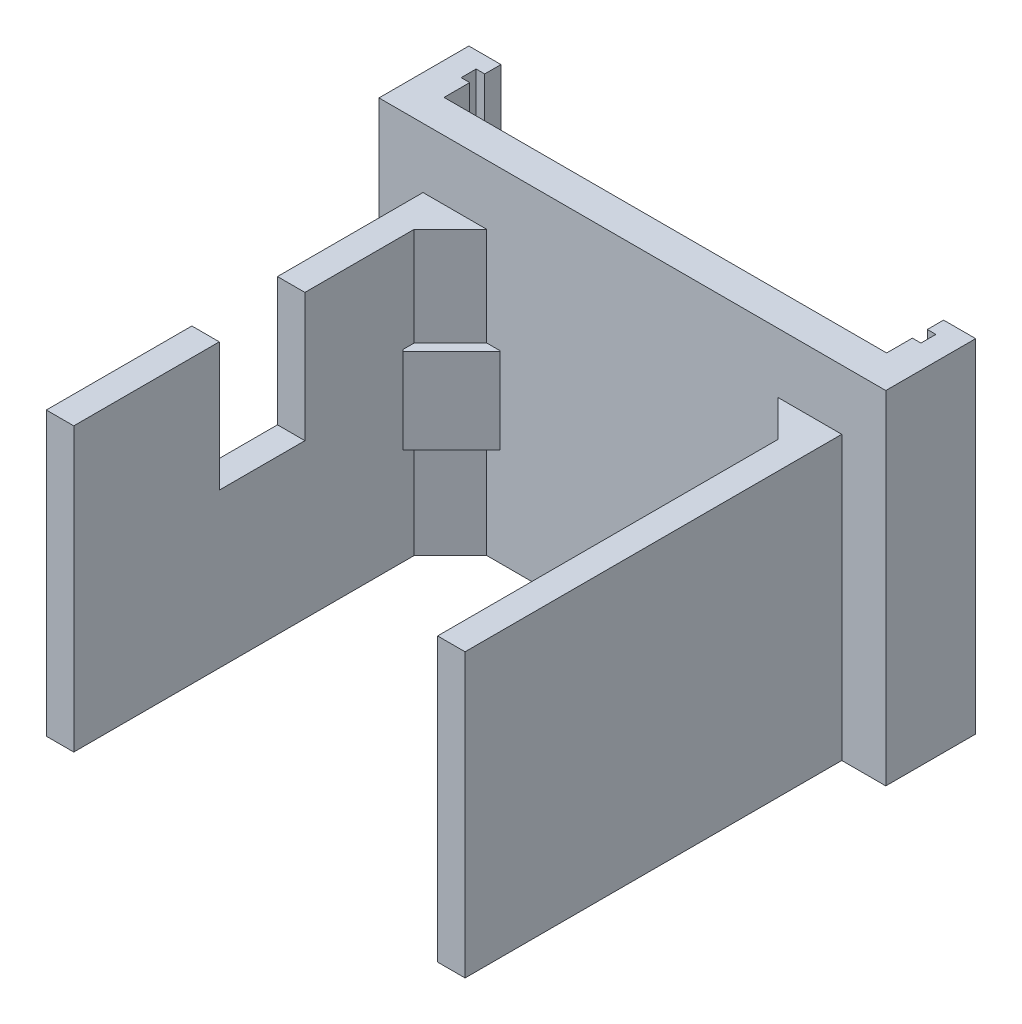
from build123d import *

# Parameters (mm, degrees)
SKETCH1_W             = 3.207256709
SKETCH1_H             = 44
BOSS_EXTRUDE2_DEPTH   = 33
BOSS_EXTRUDE2_2_DEPTH = 33
BOSS_EXTRUDE3_DEPTH   = 40
CHAMFER4_SIZE         = 4.23
SKETCH2_W             = 8
SKETCH2_H             = 10
BOSS_EXTRUDE4_DEPTH   = 1.2
SKETCH3_W             = 10
SKETCH3_H             = 10
BOSS_EXTRUDE5_DEPTH   = 1.2
SKETCH4_W             = 3.207256709
SKETCH4_H             = 10
CUT_EXTRUDE1_DEPTH    = 15


with BuildPart() as part:
    # Sketch1 → Boss-Extrude2 (new body)
    with BuildSketch(Plane(origin=(0, 0, 0), x_dir=(1, 0, 0), z_dir=(0, 1, 0))):
        with Locations((-22.853628355, 0)):
            Rectangle(SKETCH1_W, SKETCH1_H)
    extrude(amount=BOSS_EXTRUDE2_DEPTH)



with BuildPart() as body_2:
    # Sketch1 → Boss-Extrude2 2 (new body)
    with BuildSketch(Plane(origin=(0, 0, 0), x_dir=(1, 0, 0), z_dir=(0, 1, 0))):
        with Locations((22.853628355, 0)):
            Rectangle(SKETCH1_W, SKETCH1_H)
    extrude(amount=BOSS_EXTRUDE2_2_DEPTH)


with BuildPart() as part_1:
    add(part.part)

    add(body_2.part)  # Boss-Extrude3 merges body 2
    # Sketch1<6> → Boss-Extrude3 (add)
    with BuildSketch(Plane(origin=(0, 0, 0), x_dir=(1, 0, 0), z_dir=(0, 1, 0))):
        Polygon((-25.85, 28.85), (-26.85, 28.85), (-26.85, 30.6), (-25.85, 30.6), (-25.85, 32.5), (-29.6, 32.5), (-29.6, 22), (-24.457256709, 22), (-21.25, 22), (21.25, 22), (23.75, 22), (24.457256709, 22), (29.6, 22), (29.6, 32.5), (25.85, 32.5), (25.85, 30.6), (26.85, 30.6), (26.85, 28.85), (25.85, 28.85), (25.85, 25.85), (-25.85, 25.85), align=None)
    extrude(amount=BOSS_EXTRUDE3_DEPTH)

    # Chamfer4
    chamfer4_edges = [part_1.edges().sort_by_distance(p)[0] for p in [
        (21.25, 16.5, -22),
        (-21.25, 16.5, -22),
    ]]
    chamfer(chamfer4_edges, length=CHAMFER4_SIZE)

    # Sketch2 → Boss-Extrude4 (add)
    with BuildSketch(Plane(origin=(-19.51, 0, -19.51), x_dir=(0.7071067811865509, 0, -0.7071067811865442), z_dir=(0.7071067811865442, 0, 0.7071067811865509))):
        with Locations((0.603606398, 16.5)):
            Rectangle(SKETCH2_W, SKETCH2_H)
    extrude(amount=BOSS_EXTRUDE4_DEPTH)

    # Sketch3 → Boss-Extrude5 (add)
    with BuildSketch(Plane(origin=(19.51, 0, -19.51), x_dir=(0.7071067811865442, 0, 0.7071067811865509), z_dir=(-0.7071067811865509, 0, 0.7071067811865442))):
        with Locations((-0.530330086, 16.5)):
            Rectangle(SKETCH3_W, SKETCH3_H)
    extrude(amount=BOSS_EXTRUDE5_DEPTH)

    # Sketch4 → Cut-Extrude1 (cut)
    with BuildSketch(Plane(origin=(0, 33, 0), x_dir=(1, 0, 0), z_dir=(0, 1, 0))):
        with Locations((-22.853628355, 0)):
            Rectangle(SKETCH4_W, SKETCH4_H)
    extrude(amount=-CUT_EXTRUDE1_DEPTH, mode=Mode.SUBTRACT)


solid = part_1.part
